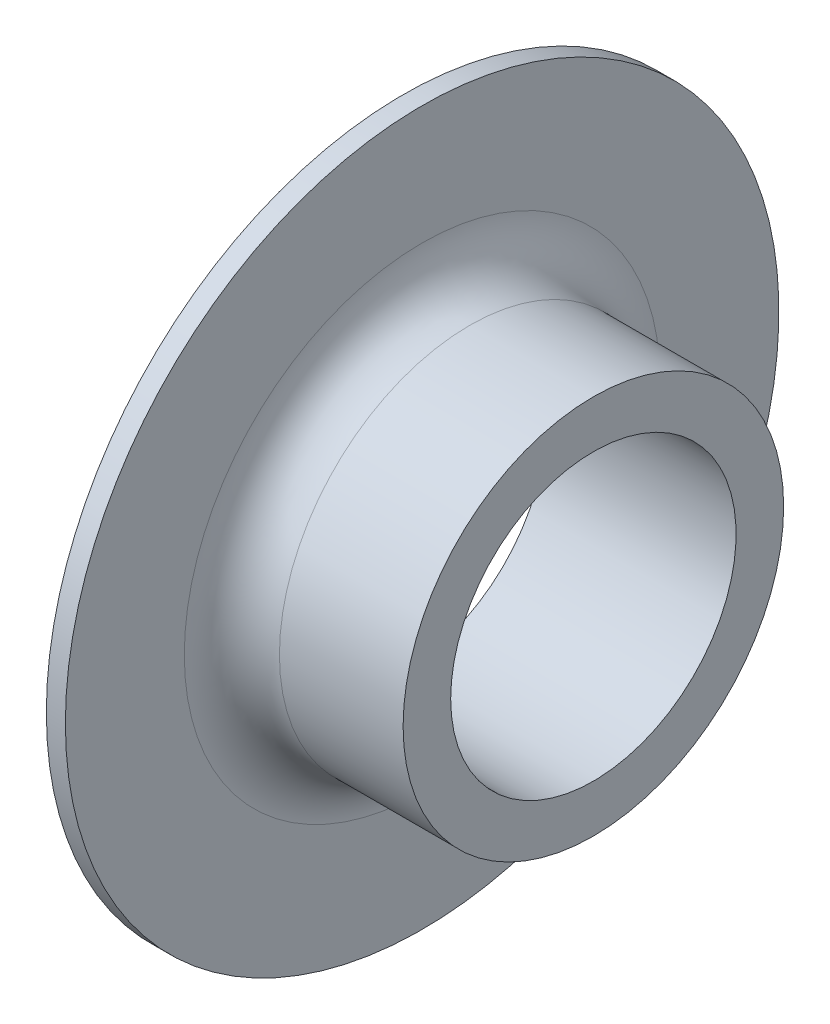
from build123d import *

# Parameters (mm, degrees)
RADYUS1_R = 5


with BuildPart() as part:
    # Çizim1 → Döndür1 (revolve)
    with BuildSketch(Plane.XY, mode=Mode.PRIVATE) as d_nd_r1_sk:
        Polygon((0, 37.5), (0, 15), (20, 15), (20, 20), (2, 20), (2, 37.5), align=None)
    revolve(d_nd_r1_sk.sketch.rotate(Axis((0, 0, 0), (1, 0, 0)), 90), axis=Axis((0, 0, 0), (1, 0, 0)))

    # Radyus1
    radyus1_edges = [part.edges().sort_by_distance(p)[0] for p in [
        (2, 0, -20),
    ]]
    fillet(radyus1_edges, radius=RADYUS1_R)


solid = part.part
